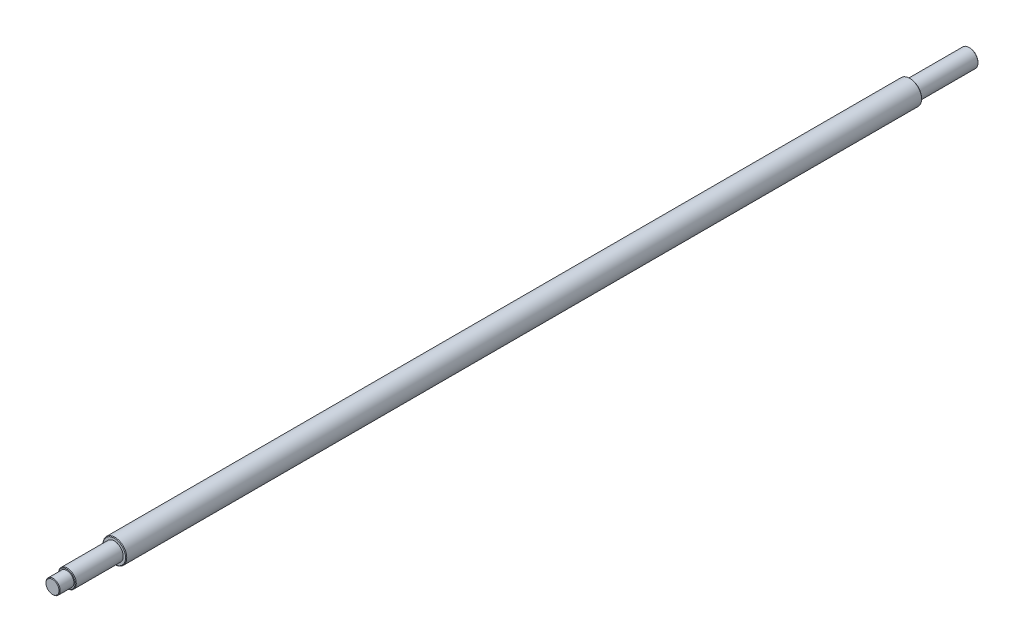
from build123d import *

# Parameters (mm, degrees)
SKETCH1_R           = 10
BOSS_EXTRUDE1_DEPTH = 335
SKETCH4_R           = 7.5
BOSS_EXTRUDE2_DEPTH = 40
SKETCH5_R           = 6
BOSS_EXTRUDE3_DEPTH = 12
BOSS_EXTRUDE5_START = 50
SKETCH11_R          = 7.5
BOSS_EXTRUDE5_DEPTH = 50
CHAMFER2_SIZE       = 0.5


with BuildPart() as part:
    # Sketch1 → Boss-Extrude1 (new, symmetric)
    with BuildSketch(Plane.XY):
        Circle(SKETCH1_R)
    extrude(amount=BOSS_EXTRUDE1_DEPTH, both=True)

    # Sketch4 → Boss-Extrude2 (add)
    with BuildSketch(Plane.XY.offset(335)):
        Circle(SKETCH4_R)
    extrude(amount=BOSS_EXTRUDE2_DEPTH)

    # Sketch5 → Boss-Extrude3 (add)
    with BuildSketch(Plane.XY.offset(375)):
        Circle(SKETCH5_R)
    extrude(amount=BOSS_EXTRUDE3_DEPTH)

    # Sketch11 → Boss-Extrude5 (add)
    with BuildSketch(Plane(origin=(0, 0, -335), x_dir=(-1, 0, 0), z_dir=(0, 0, -1)).offset(BOSS_EXTRUDE5_START)):
        Circle(SKETCH11_R)
    extrude(amount=-BOSS_EXTRUDE5_DEPTH)

    # Chamfer2
    chamfer2_edges = [part.edges().sort_by_distance(p)[0] for p in [
        (7.5, 0, -385),
        (-6, 0, 387),
        (-10, 0, -335),
        (-7.5, 0, 375),
        (-10, 0, 335),
    ]]
    chamfer(chamfer2_edges, length=CHAMFER2_SIZE)


solid = part.part
